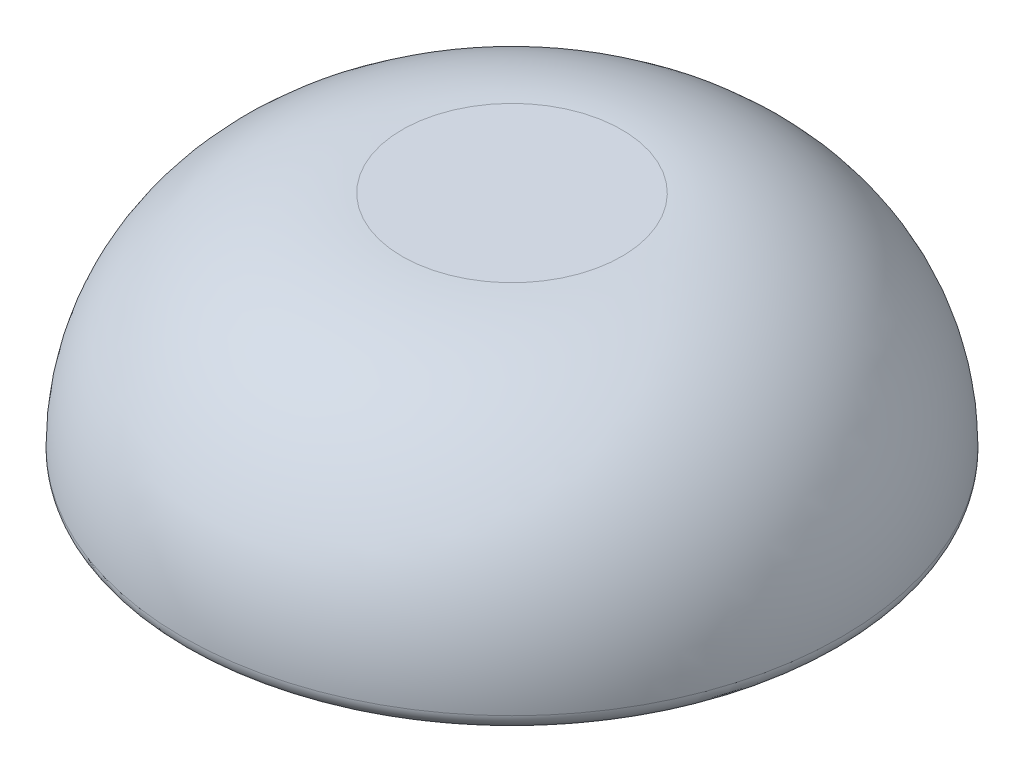
from build123d import *

# Parameters (mm, degrees)
SKETCH3_W          = 3
SKETCH3_H          = 8
CUT_EXTRUDE1_DEPTH = 10
CIRPATTERN1_COUNT  = 6
CHAMFER1_SIZE      = 0.5


with BuildPart() as part:
    # Sketch1 → Revolve1 (revolve)
    with BuildSketch(Plane.XY, mode=Mode.PRIVATE) as revolve1_sk:
        with BuildLine():
            Line((0, 30), (10, 30))
            ThreePointArc((10, 30), (24.142135624, 24.142135624), (30, 10))
            ThreePointArc((30, 10), (28.5, 8.5), (27, 10))
            ThreePointArc((27, 10), (22.511577448, 21.509145484), (11.416420028, 26.940890009))
            ThreePointArc((11.416420028, 26.940890009), (7.630166884, 25.6522431), (6, 22))
            Line((6, 22), (6, 0))
            Line((6, 0), (3.8, 0))
            Line((3.8, 0), (3.8, 25))
            Line((3.8, 25), (0, 25))
            Line((0, 25), (0, 30))
        make_face()
    revolve(revolve1_sk.sketch.rotate(Axis((0, 33.38672529, 0), (0, -1, 0)), 90), axis=Axis((0, 33.38672529, 0), (0, -1, 0)))

    # Sketch3 → Cut-Extrude1 (cut)
    with BuildSketch(Plane.XY):
        with Locations((0, 18.5)):
            Rectangle(SKETCH3_W, SKETCH3_H)
    cut_extrude1 = extrude(amount=-CUT_EXTRUDE1_DEPTH, mode=Mode.SUBTRACT)

    # CirPattern1: Cut-Extrude1 ×6 about axis
    cirpattern1_axis = Axis((0, 0, 0), (0, 1, 0))
    for i in range(1, CIRPATTERN1_COUNT):
        add(cut_extrude1.rotate(cirpattern1_axis, i * 360 / CIRPATTERN1_COUNT), mode=Mode.SUBTRACT)

    # Chamfer1
    chamfer1_edges = [part.edges().sort_by_distance(p)[0] for p in [
        (0, 0, -3.8),
    ]]
    chamfer(chamfer1_edges, length=CHAMFER1_SIZE)


solid = part.part
